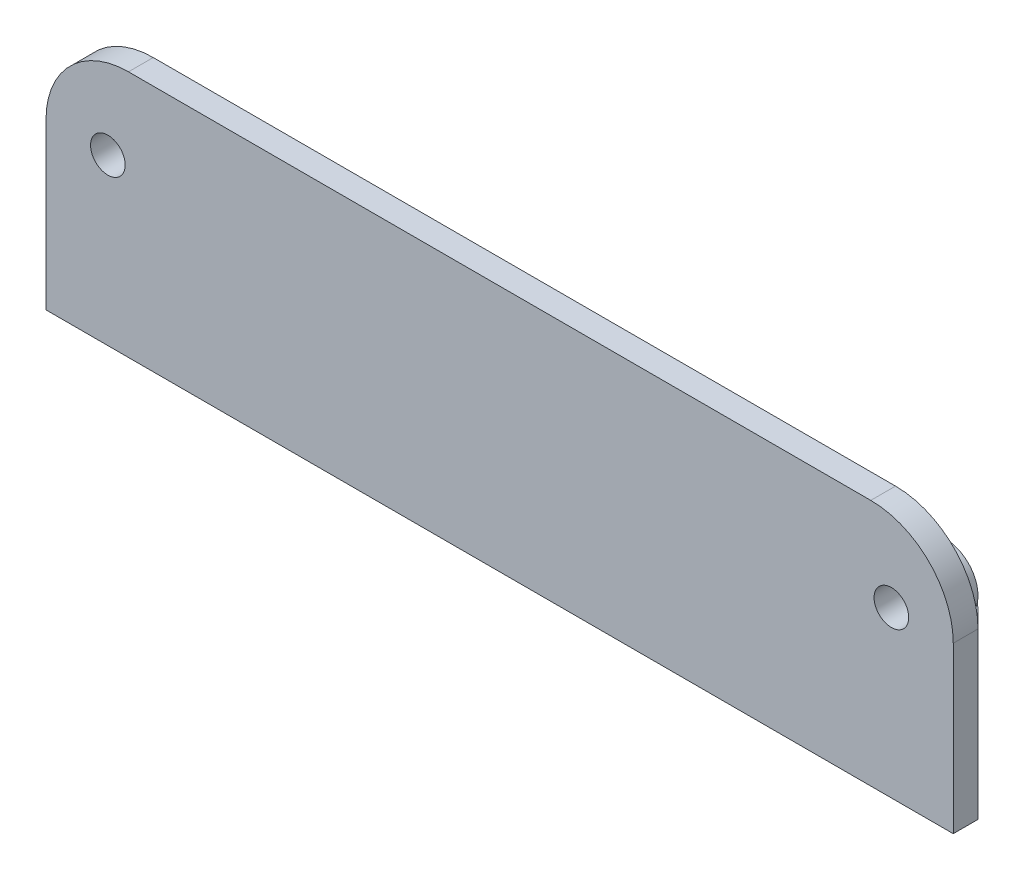
from build123d import *

# Parameters (mm, degrees)
SKETCH1_W            = 110
SKETCH1_H            = 30
SKETCH1_R            = 2.25
EXTRUDE_1_DEPTH      = 5
SKETCH_1_W           = 110
SKETCH_1_H           = 30
SKETCH_1_R           = 2.1
EXTRUDE_2_DEPTH      = 3
FILLET_2_R           = 10
CHAMFER1_SIZE        = 30
EXTRUDE_3_DEPTH      = 38
EXTRUDE_3_DEPTH_BACK = 38
SKETCH_3_W           = 12
SKETCH_3_H           = 15
CUT_EXTRUDE_1_DEPTH  = 64.03967005
BOSS_EXTRUDE1_START  = 3.5
SKETCH3_R            = 4
SKETCH3_R_2          = 2.1
BOSS_EXTRUDE1_DEPTH  = 3.5
SKETCH4_W            = 114.569016578
SKETCH4_H            = 20
CUT_EXTRUDE1_DEPTH   = 64.03967005
FILLET1_R            = 10


with BuildPart() as part:
    # Sketch1 → Бобышка-Вытянуть1 (new body)
    with BuildSketch(Plane(origin=(0, 0, 0), x_dir=(1, 0, 0), z_dir=(0, 1, 0))):
        Rectangle(SKETCH1_W, SKETCH1_H)
        with Locations(Location((-20, -6, 0), (0, 0, 270))):
            Circle(SKETCH1_R, mode=Mode.SUBTRACT)
        with Locations(Location((20, -6, 0), (0, 0, 90))):
            Circle(SKETCH1_R, mode=Mode.SUBTRACT)
    extrude(amount=EXTRUDE_1_DEPTH)

    # Эскиз1 → Бобышка-Вытянуть2 (add)
    with BuildSketch(Plane.XY.offset(15)):
        with Locations((0, 15)):
            Rectangle(SKETCH_1_W, SKETCH_1_H)
        with Locations((-47.5, 20)):
            Circle(SKETCH_1_R, mode=Mode.SUBTRACT)
        with Locations(Location((47.5, 20, 0), (0, 0, 180))):
            Circle(SKETCH_1_R, mode=Mode.SUBTRACT)
    extrude(amount=EXTRUDE_2_DEPTH)

    # Скругление2
    fillet_2_edges = [part.edges().sort_by_distance(p)[0] for p in [
        (-55, 30, 16.5),
        (55, 30, 16.5),
    ]]
    fillet(fillet_2_edges, radius=FILLET_2_R)

    # Chamfer1
    chamfer1_edges = [part.edges().sort_by_distance(p)[0] for p in [
        (-55, 2.5, -15),
        (55, 2.5, -15),
    ]]
    chamfer(chamfer1_edges, length=CHAMFER1_SIZE)

    # Эскиз2 → Бобышка-Вытянуть3 (add, two sides: drawn at the far end of the back side and taken through both)
    with BuildSketch(Plane(origin=(0, 0, 0), x_dir=(0, 0, -1), z_dir=(1, 0, 0)).offset(-EXTRUDE_3_DEPTH_BACK)):
        Polygon((-15, 30), (0, 5), (-15, 5), align=None)
    extrude(amount=EXTRUDE_3_DEPTH + EXTRUDE_3_DEPTH_BACK)

    # Эскиз3 → Вырез-Вытянуть1 (cut, through all)
    with BuildSketch(Plane(origin=(0, 5, 0), x_dir=(1, 0, 0), z_dir=(0, 1, 0))):
        with Locations((20, -7.5)):
            Rectangle(SKETCH_3_W, SKETCH_3_H)
        with Locations((-20, -7.5)):
            Rectangle(SKETCH_3_W, SKETCH_3_H)
        with Locations((0, -7.5)):
            Rectangle(SKETCH_3_W, SKETCH_3_H)
    extrude(amount=CUT_EXTRUDE_1_DEPTH, mode=Mode.SUBTRACT)

    # Sketch3 → Boss-Extrude1 (add)
    # profile 1 of 2: a face of its own
    with BuildSketch(Plane(origin=(0, 0, 15), x_dir=(-1, 0, 0), z_dir=(0, 0, -1)).offset(BOSS_EXTRUDE1_START)):
        with Locations((-47.5, 20)):
            Circle(SKETCH3_R)
        with Locations((-47.5, 20)):
            Circle(SKETCH3_R_2, mode=Mode.SUBTRACT)
    # profile 2 of 2: a face of its own
    with BuildSketch(Plane(origin=(0, 0, 15), x_dir=(-1, 0, 0), z_dir=(0, 0, -1)).offset(BOSS_EXTRUDE1_START)):
        with Locations(Location((47.5, 20, 0), (0, 0, 180))):
            Circle(SKETCH3_R)
        with Locations(Location((47.5, 20, 0), (0, 0, 180))):
            Circle(SKETCH3_R_2, mode=Mode.SUBTRACT)
    extrude(amount=-BOSS_EXTRUDE1_DEPTH)

    # Sketch4 → Cut-Extrude1 (cut, through all)
    with BuildSketch(Plane(origin=(0, 5, 0), x_dir=(1, 0, 0), z_dir=(0, 1, 0))):
        with Locations((0, 15)):
            Rectangle(SKETCH4_W, SKETCH4_H)
    extrude(amount=-CUT_EXTRUDE1_DEPTH, mode=Mode.SUBTRACT)

    # Fillet1
    fillet1_edges = [part.edges().sort_by_distance(p)[0] for p in [
        (35, 2.5, -5),
        (-35, 2.5, -5),
    ]]
    fillet(fillet1_edges, radius=FILLET1_R)


solid = part.part
